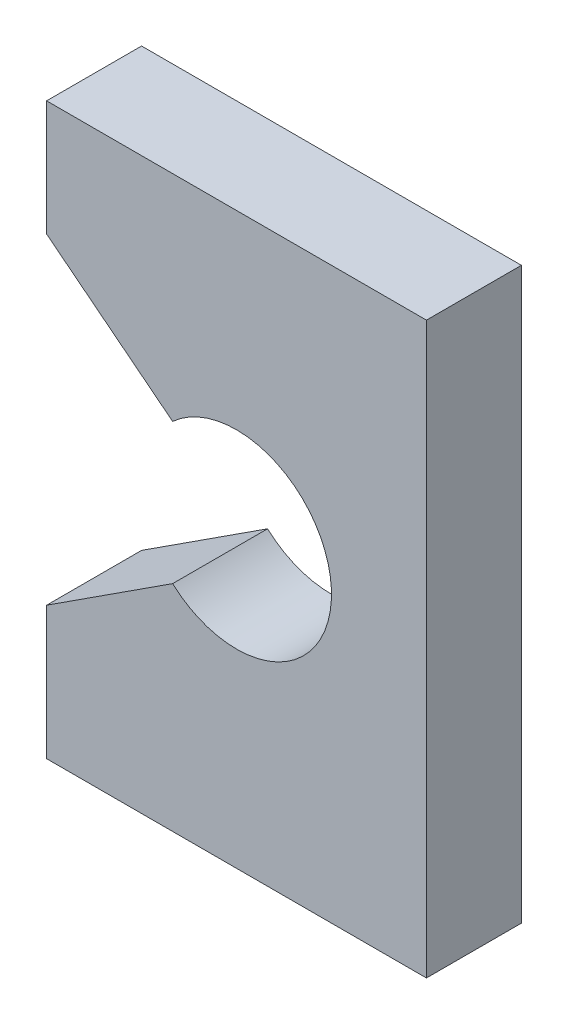
from build123d import *

# Parameters (mm, degrees)
BOSS_EXTRU_1_DEPTH = 5


with BuildPart() as part:
    # Esquisse1 → Boss.-Extru.1 (new body)
    with BuildSketch(Plane.XY):
        with BuildLine():
            Line((-10, 15), (-10, 8.925037924))
            Line((-10, 8.925037924), (-3.364765454, 3.698425806))
            ThreePointArc((-3.364765454, 3.698425806), (5, 0), (-3.364765454, -3.698425806))
            Line((-3.364765454, -3.698425806), (-10, -8))
            Line((-10, -8), (-10, -15))
            Line((-10, -15), (10, -15))
            Line((10, -15), (10, 15))
            Line((10, 15), (-10, 15))
        make_face()
    extrude(amount=BOSS_EXTRU_1_DEPTH)


solid = part.part
